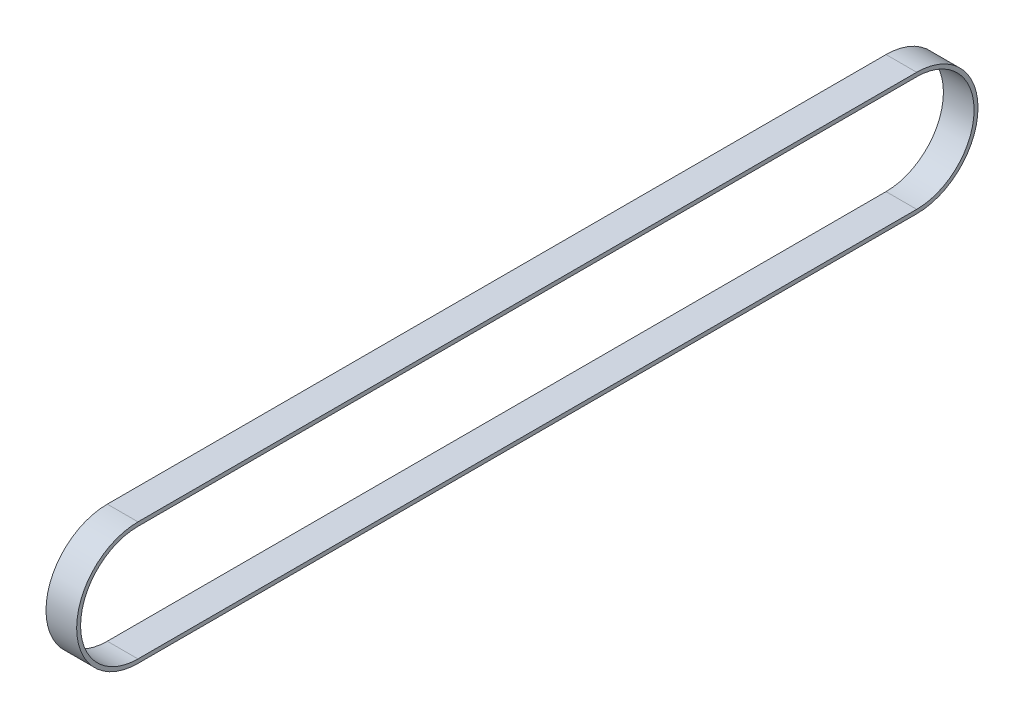
from build123d import *

# Parameters (mm, degrees)
BOSS_EXTRUDE1_DEPTH = 15


with BuildPart() as part:
    # Sketch1 → Boss-Extrude1 (new body)
    with BuildSketch(Plane(origin=(0, 0, 0), x_dir=(0, 0, -1), z_dir=(1, 0, 0))):
        with BuildLine():
            Line((0, 29.999999944), (381, 29.999999944))
            ThreePointArc((381, 29.999999944), (410.999999944, 0), (381, -29.999999944))
            Line((381, -29.999999944), (0, -29.999999944))
            ThreePointArc((0, -29.999999944), (-29.999999944, 0), (0, 29.999999944))
        make_face()
        with BuildLine():
            Line((0, 28.079999974), (381, 28.079999974))
            ThreePointArc((381, 28.079999974), (409.079999974, 0), (381, -28.079999974))
            Line((381, -28.079999974), (0, -28.079999974))
            ThreePointArc((0, -28.079999974), (-28.079999974, 0), (0, 28.079999974))
        make_face(mode=Mode.SUBTRACT)
    extrude(amount=BOSS_EXTRUDE1_DEPTH)


solid = part.part
